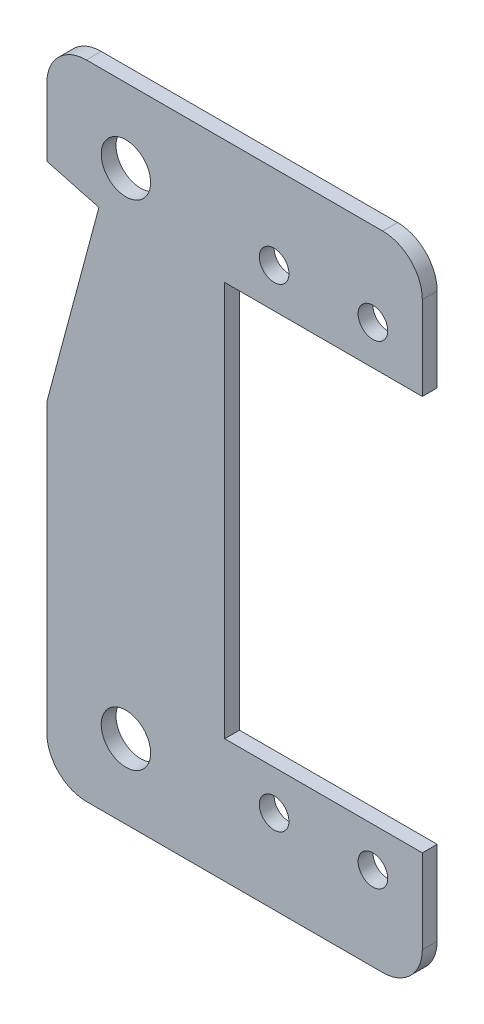
from build123d import *

# Parameters (mm, degrees)
ESQUISSE1_R             = 2.5
ESQUISSE1_R_2           = 1.5
BOSS_EXTRU_1_DEPTH      = 1.5
CONG_1_R                = 4
ENL_V_MAT_EXTRU_1_DEPTH = 51.024993753


with BuildPart() as part:
    # Esquisse1 → Boss.-Extru.1 (new body)
    with BuildSketch(Plane.XY):
        Polygon((38, -20), (38, -32.5), (0, -32.5), (0, 32.5), (38, 32.5), (38, 20), (18, 20), (18, -20), align=None)
        with Locations((8, 25)):
            Circle(ESQUISSE1_R, mode=Mode.SUBTRACT)
        with Locations((23, 24)):
            Circle(ESQUISSE1_R_2, mode=Mode.SUBTRACT)
        with Locations(Location((33, 24, 0), (0, 0, 180))):
            Circle(ESQUISSE1_R_2, mode=Mode.SUBTRACT)
        with Locations((33, -24)):
            Circle(ESQUISSE1_R_2, mode=Mode.SUBTRACT)
        with Locations(Location((23, -24, 0), (0, 0, 180))):
            Circle(ESQUISSE1_R_2, mode=Mode.SUBTRACT)
        with Locations(Location((8, -25, 0), (0, 0, 180))):
            Circle(ESQUISSE1_R, mode=Mode.SUBTRACT)
    extrude(amount=BOSS_EXTRU_1_DEPTH)

    # Congé1
    cong_1_edges = [part.edges().sort_by_distance(p)[0] for p in [
        (38, -32.5, 0.75),
        (0, -32.5, 0.75),
        (0, 32.5, 0.75),
        (38, 32.5, 0.75),
    ]]
    fillet(cong_1_edges, radius=CONG_1_R)

    # Esquisse2 → Enlèv. mat.-Extru.1 (cut, through all)
    with BuildSketch(Plane.XY.offset(1.5)):
        Polygon((0, 21.617026009), (5.268332191, 20.205380653), (0, 0.543697246), align=None)
    extrude(amount=-ENL_V_MAT_EXTRU_1_DEPTH, mode=Mode.SUBTRACT)


solid = part.part
